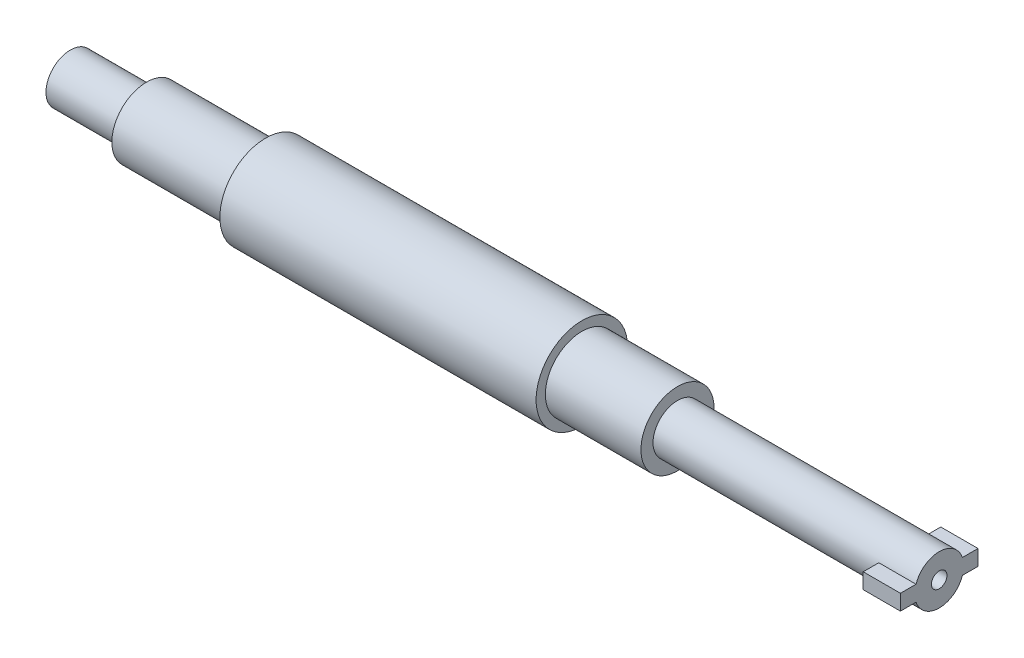
from build123d import *

# Parameters (mm, degrees)
SKETCH1_R            = 5
SHAFT_DEPTH          = 177.8
SKETCH2_W            = 15.875
SKETCH2_H            = 3.175
SHAFT_KEY_MALE_DEPTH = 7.62
SKETCH3_R            = 1.5875
BOLT_BORE_DEPTH      = 50.8
SKETCH4_R            = 4
CUT_EXTRUDE1_DEPTH   = 25.4


with BuildPart() as part:
    # Sketch1 → Shaft (new body)
    with BuildSketch(Plane(origin=(0, 0, 0), x_dir=(0, 0, -1), z_dir=(1, 0, 0))):
        Circle(SKETCH1_R)
    extrude(amount=SHAFT_DEPTH)

    # Sketch2 → Shaft Key Male (add)
    with BuildSketch(Plane(origin=(177.8, 0, 0), x_dir=(0, 0, -1), z_dir=(1, 0, 0))):
        Rectangle(SKETCH2_W, SKETCH2_H)
    extrude(amount=-SHAFT_KEY_MALE_DEPTH)

    # Sketch3 → Bolt Bore (cut)
    with BuildSketch(Plane(origin=(177.8, 0, 0), x_dir=(0, 0, -1), z_dir=(1, 0, 0))):
        Circle(SKETCH3_R)
    extrude(amount=-BOLT_BORE_DEPTH, mode=Mode.SUBTRACT)

    # Sketch4 → Cut-Extrude1 (cut)
    with BuildSketch(Plane.ZY):
        Circle(SKETCH4_R)
    extrude(amount=-CUT_EXTRUDE1_DEPTH, mode=Mode.SUBTRACT)

    # Sketch5 → Revolve1 (revolve)
    with BuildSketch(Plane(origin=(0, 0, 0), x_dir=(1, 0, 0), z_dir=(0, 1, 0)), mode=Mode.PRIVATE) as revolve1_sk:
        Polygon((144.055202203, 0), (15.578475915, 0), (15.578475915, -7.096721058), (39.957910275, -7.096721058), (39.957910275, -9.367671796), (104.670198298, -9.367671796), (104.670198298, -7.475212847), (124.236525445, -7.475212847), (124.236525445, -5), (144.055202203, -5), align=None)
    revolve(revolve1_sk.sketch.rotate(Axis((144.055202203, 0, 0), (-1, 0, 0)), 180), axis=Axis((144.055202203, 0, 0), (-1, 0, 0)))


solid = part.part
